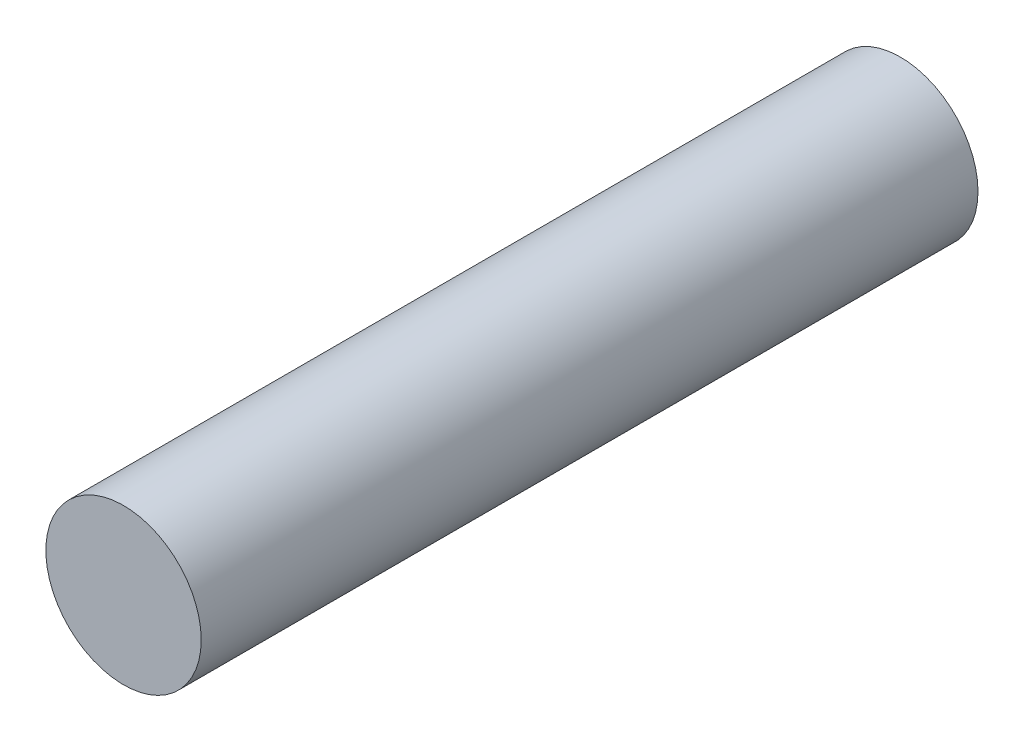
from build123d import *

# Parameters (mm, degrees)
CROSS_SECTION_SKETCH_R      = 7.5
CROSS_SECTION_EXTRUDE_DEPTH = 75


with BuildPart() as part:
    # Cross Section Sketch → Cross Section Extrude (new body)
    with BuildSketch(Plane.XY):
        Circle(CROSS_SECTION_SKETCH_R)
    extrude(amount=CROSS_SECTION_EXTRUDE_DEPTH)


solid = part.part
